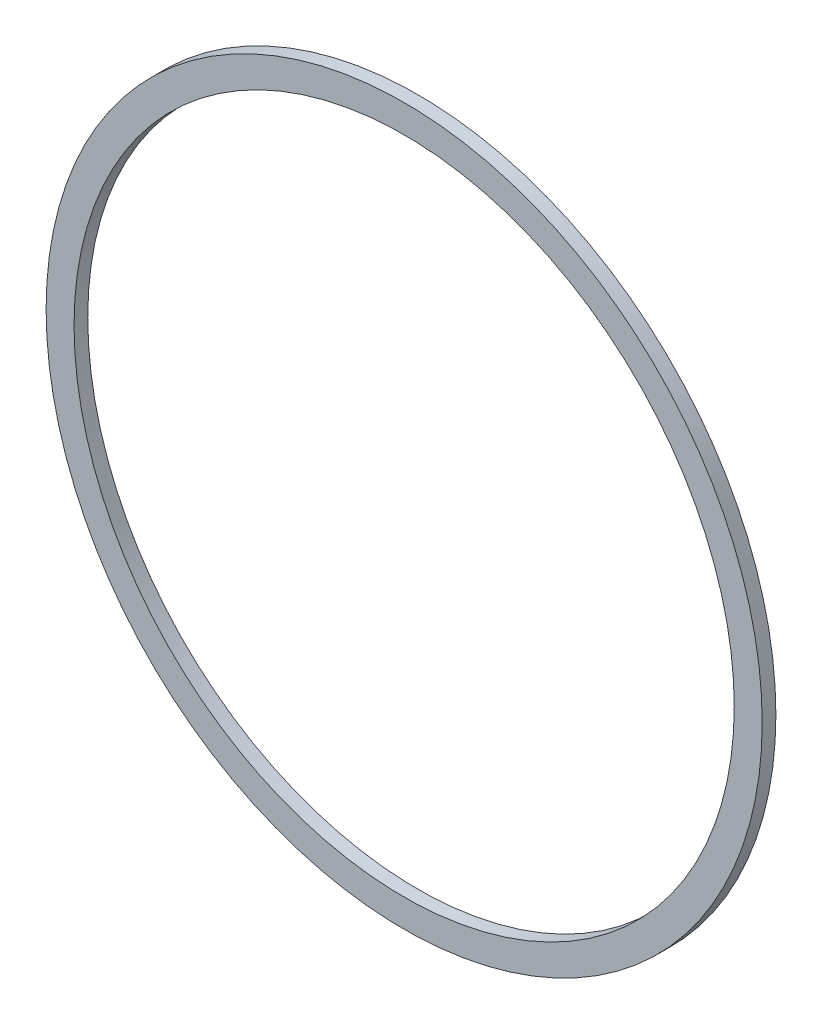
from build123d import *

# Parameters (mm, degrees)
SKETCH1_R           = 82.9945
BOSS_EXTRUDE1_DEPTH = 3.175
SKETCH2_R           = 76.5175
CUT_EXTRUDE1_DEPTH  = 118.414882726


with BuildPart() as part:
    # Sketch1 → Boss-Extrude1 (new body)
    with BuildSketch(Plane.XY):
        Circle(SKETCH1_R)
    extrude(amount=BOSS_EXTRUDE1_DEPTH)

    # Sketch2 → Cut-Extrude1 (cut, through all)
    with BuildSketch(Plane(origin=(0, 0, 0), x_dir=(-1, 0, 0), z_dir=(0, 0, -1))):
        Circle(SKETCH2_R)
    extrude(amount=-CUT_EXTRUDE1_DEPTH, mode=Mode.SUBTRACT)


solid = part.part
